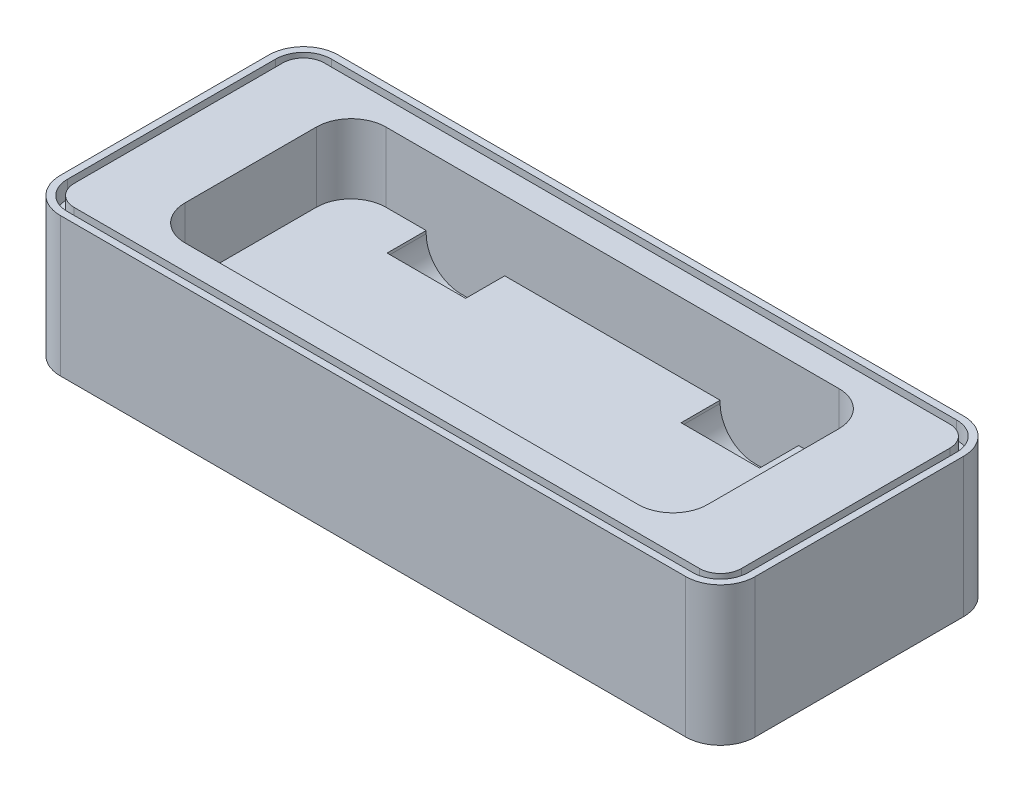
from build123d import *

# Parameters (mm, degrees)
SKETCH1_W           = 10
SKETCH1_H           = 2
BOSS_EXTRUDE1_DEPTH = 4
SKETCH2_W           = 7.52
SKETCH2_H           = 2.89
CUT_EXTRUDE1_DEPTH  = 1
FILLET1_R           = 0.5
FILLET2_R           = 0.5
SKETCH5_W           = 1.13
SKETCH5_H           = 0.562
CUT_EXTRUDE3_DEPTH  = 0.54
CUT_EXTRUDE8_DEPTH  = 0.25
FILLET4_R           = 0.5


with BuildPart() as part:
    # Sketch1 → Boss-Extrude1 (new body)
    with BuildSketch(Plane.XY):
        with Locations((5, -1)):
            Rectangle(SKETCH1_W, SKETCH1_H)
    extrude(amount=-BOSS_EXTRUDE1_DEPTH)

    # Sketch2 → Cut-Extrude1 (cut)
    with BuildSketch(Plane(origin=(0, 0, 0), x_dir=(1, 0, 0), z_dir=(0, 1, 0))):
        with Locations((5, 2)):
            Rectangle(SKETCH2_W, SKETCH2_H)
    extrude(amount=-CUT_EXTRUDE1_DEPTH, mode=Mode.SUBTRACT)

    # Fillet1
    fillet1_edges = [part.edges().sort_by_distance(p)[0] for p in [
        (10, -1, -4),
        (0, -1, -4),
        (10, -1, 0),
        (0, -1, 0),
    ]]
    fillet(fillet1_edges, radius=FILLET1_R)

    # Fillet2
    fillet2_edges = [part.edges().sort_by_distance(p)[0] for p in [
        (8.76, -0.5, -3.445),
        (8.76, -0.5, -0.555),
        (1.24, -0.5, -0.555),
        (1.24, -0.5, -3.445),
    ]]
    fillet(fillet2_edges, radius=FILLET2_R)

    # Sketch5 → Cut-Extrude3 (cut)
    with BuildSketch(Plane(origin=(0, -1, 0), x_dir=(1, 0, 0), z_dir=(0, 1, 0))):
        with Locations((2.885, 3.164)):
            Rectangle(SKETCH5_W, SKETCH5_H)
        with Locations((7.115, 3.164)):
            Rectangle(SKETCH5_W, SKETCH5_H)
        with Locations((7.115, 0.836)):
            Rectangle(SKETCH5_W, SKETCH5_H)
        with Locations((2.885, 0.836)):
            Rectangle(SKETCH5_W, SKETCH5_H)
    extrude(amount=-CUT_EXTRUDE3_DEPTH, mode=Mode.SUBTRACT)

    # Sketch9 → Cut-Extrude8 (cut)
    with BuildSketch(Plane(origin=(0, 0, 0), x_dir=(1, 0, 0), z_dir=(0, 1, 0))):
        with BuildLine():
            Line((9.9, 0.5), (9.9, 3.5))
            ThreePointArc((9.9, 3.5), (9.782842712, 3.782842712), (9.5, 3.9))
            Line((9.5, 3.9), (0.5, 3.9))
            ThreePointArc((0.5, 3.9), (0.217157288, 3.782842712), (0.1, 3.5))
            Line((0.1, 3.5), (0.1, 0.5))
            ThreePointArc((0.1, 0.5), (0.217157288, 0.217157288), (0.5, 0.1))
            Line((0.5, 0.1), (9.5, 0.1))
            ThreePointArc((9.5, 0.1), (9.782842712, 0.217157288), (9.9, 0.5))
        make_face()
        with BuildLine():
            Line((0.5, 0.2), (9.5, 0.2))
            ThreePointArc((9.5, 0.2), (9.712132034, 0.287867966), (9.8, 0.5))
            Line((9.8, 0.5), (9.8, 3.5))
            ThreePointArc((9.8, 3.5), (9.712132034, 3.712132034), (9.5, 3.8))
            Line((9.5, 3.8), (0.5, 3.8))
            ThreePointArc((0.5, 3.8), (0.287867966, 3.712132034), (0.2, 3.5))
            Line((0.2, 3.5), (0.2, 0.5))
            ThreePointArc((0.2, 0.5), (0.287867966, 0.287867966), (0.5, 0.2))
        make_face(mode=Mode.SUBTRACT)
    extrude(amount=-CUT_EXTRUDE8_DEPTH, mode=Mode.SUBTRACT)

    # Fillet4
    fillet4_edges = [part.edges().sort_by_distance(p)[0] for p in [
        (2.32, -1.54, -3.164),
        (3.45, -1.54, -3.164),
        (2.32, -1.54, -0.836),
        (3.45, -1.54, -0.836),
        (6.55, -1.54, -0.836),
        (7.68, -1.54, -0.836),
        (6.55, -1.54, -3.164),
        (7.68, -1.54, -3.164),
    ]]
    fillet(fillet4_edges, radius=FILLET4_R)


solid = part.part
